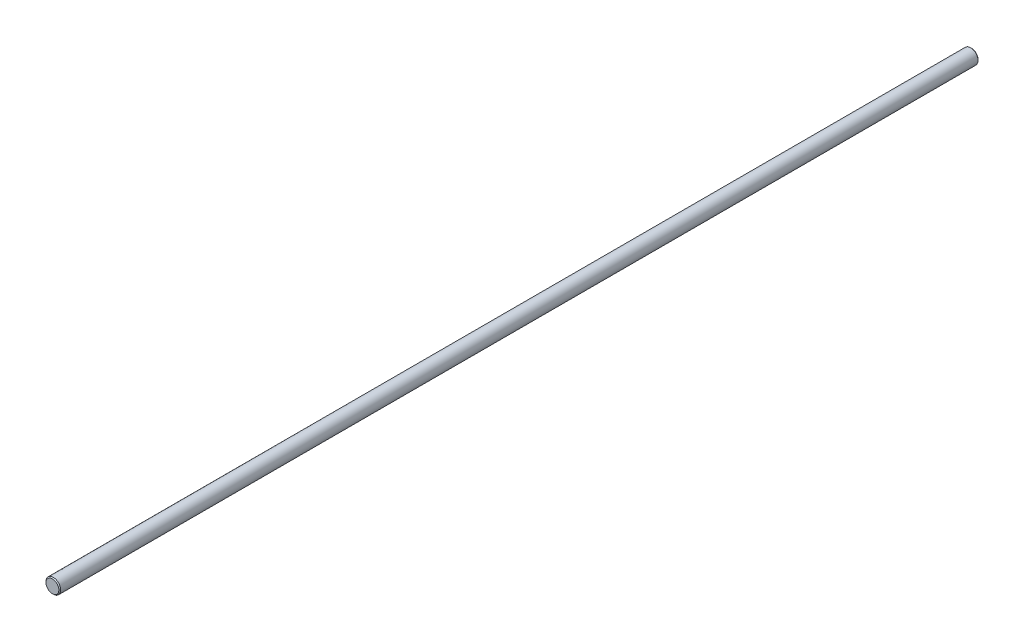
from build123d import *

# Parameters (mm, degrees)
SKETCH1_R          = 8
CORPO_DEPTH        = 1000
CHANFROS_1X45_SIZE = 1


with BuildPart() as part:
    # Sketch1 → Corpo (new body)
    with BuildSketch(Plane.XY):
        Circle(SKETCH1_R)
    extrude(amount=-CORPO_DEPTH)

    # Chanfros 1x45°
    chanfros_1x45_edges = [part.edges().sort_by_distance(p)[0] for p in [
        (-8, 0, 0),
        (-8, 0, -1000),
    ]]
    chamfer(chanfros_1x45_edges, length=CHANFROS_1X45_SIZE)


solid = part.part
